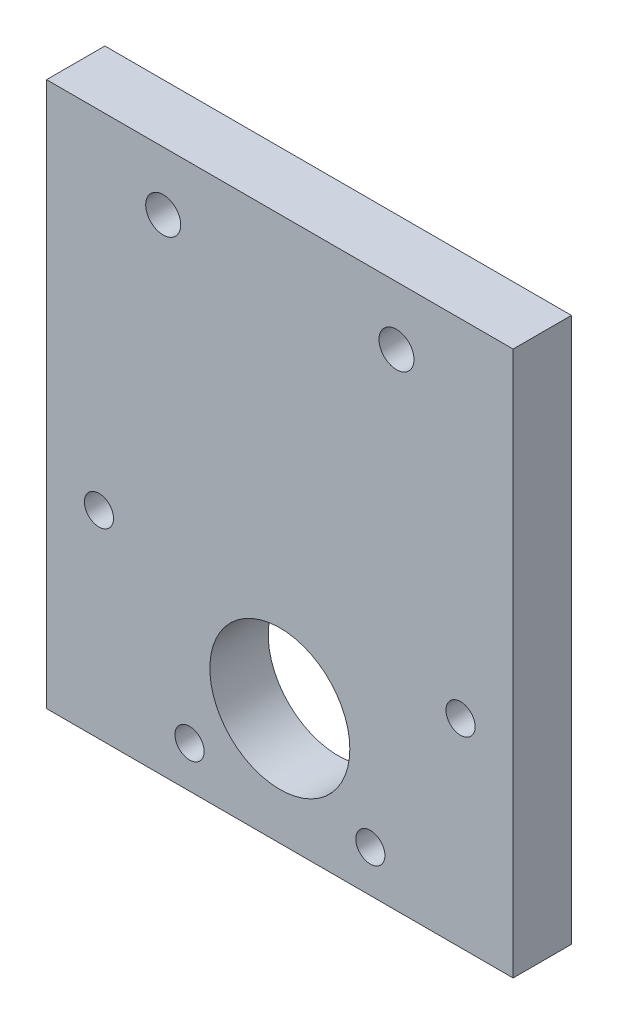
from build123d import *

# Parameters (mm, degrees)
SKETCH1_R           = 6
SKETCH1_R_2         = 1.25
SKETCH1_R_3         = 1.5
BOSS_EXTRUDE1_DEPTH = 5


with BuildPart() as part:
    # Sketch1 → Boss-Extrude1 (new body)
    with BuildSketch(Plane.XY):
        Polygon((0, -2.857142857), (40, -2.857142857), (40, 37.142857143), (40, 43.840888812), (0, 43.840888812), (0, 37.142857143), align=None)
        with Locations((20, 7.142857143)):
            Circle(SKETCH1_R, mode=Mode.SUBTRACT)
        with Locations((4.491483608, 14.123968753)):
            Circle(SKETCH1_R_2, mode=Mode.SUBTRACT)
        with Locations((12.257831183, 0.710026553)):
            Circle(SKETCH1_R_2, mode=Mode.SUBTRACT)
        with Locations((27.757819681, 0.728909749)):
            Circle(SKETCH1_R_2, mode=Mode.SUBTRACT)
        with Locations((35.491460603, 14.161735143)):
            Circle(SKETCH1_R_2, mode=Mode.SUBTRACT)
        with Locations((10, 38.807411058)):
            Circle(SKETCH1_R_3, mode=Mode.SUBTRACT)
        with Locations(Location((30, 38.807411058, 0), (0, 0, 180))):
            Circle(SKETCH1_R_3, mode=Mode.SUBTRACT)
    extrude(amount=BOSS_EXTRUDE1_DEPTH)


solid = part.part
